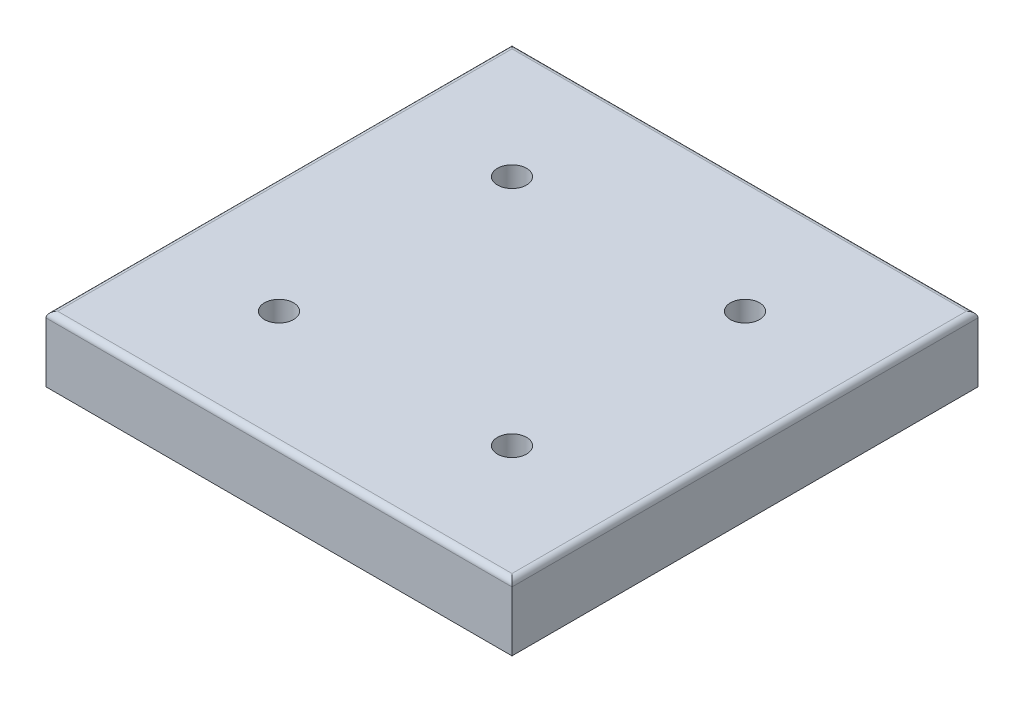
from build123d import *

# Parameters (mm, degrees)
SKETCH_1_W                  = 160
SKETCH_1_H                  = 160
EXTRUDE_1_DEPTH             = 22.5
SKETCH_2_R                  = 5
CUT_EXTRUDE_1_DEPTH         = 228.390083337
PATTERN_LINEAR_1_COUNT      = 2
PATTERN_LINEAR_1_PITCH      = 80
PATTERN_LINEAR_1_COUNT_DIR2 = 2
PATTERN_LINEAR_1_PITCH_DIR2 = 80
FILLET_2_R                  = 2


with BuildPart() as part:
    # 草图1 → 凸台-拉伸1 (new body)
    with BuildSketch(Plane(origin=(0, 0, 0), x_dir=(1, 0, 0), z_dir=(0, 1, 0))):
        with Locations((80, 80)):
            Rectangle(SKETCH_1_W, SKETCH_1_H)
    extrude(amount=EXTRUDE_1_DEPTH)

    # 草图2 → 切除-拉伸1 (cut, through all)
    with BuildSketch(Plane(origin=(0, 22.5, 0), x_dir=(1, 0, 0), z_dir=(0, 1, 0))):
        with Locations(Location((40, 120, 0), (0, 0, 270))):
            Circle(SKETCH_2_R)
    cut_extrude_1 = extrude(amount=-CUT_EXTRUDE_1_DEPTH, mode=Mode.SUBTRACT)

    # 阵列(线性)1: Cut-Extrude 1 2 × 2
    with Locations(*[(i * PATTERN_LINEAR_1_PITCH, 0, j * PATTERN_LINEAR_1_PITCH_DIR2) for i in range(PATTERN_LINEAR_1_COUNT) for j in range(PATTERN_LINEAR_1_COUNT_DIR2) if (i, j) != (0, 0)]):
        add(cut_extrude_1, mode=Mode.SUBTRACT)

    # 圆角2
    fillet_2_edges = [part.edges().sort_by_distance(p)[0] for p in [
        (160, 22.5, -80),
        (80, 22.5, -160),
        (0, 22.5, -80),
        (80, 22.5, 0),
    ]]
    fillet(fillet_2_edges, radius=FILLET_2_R)


solid = part.part
